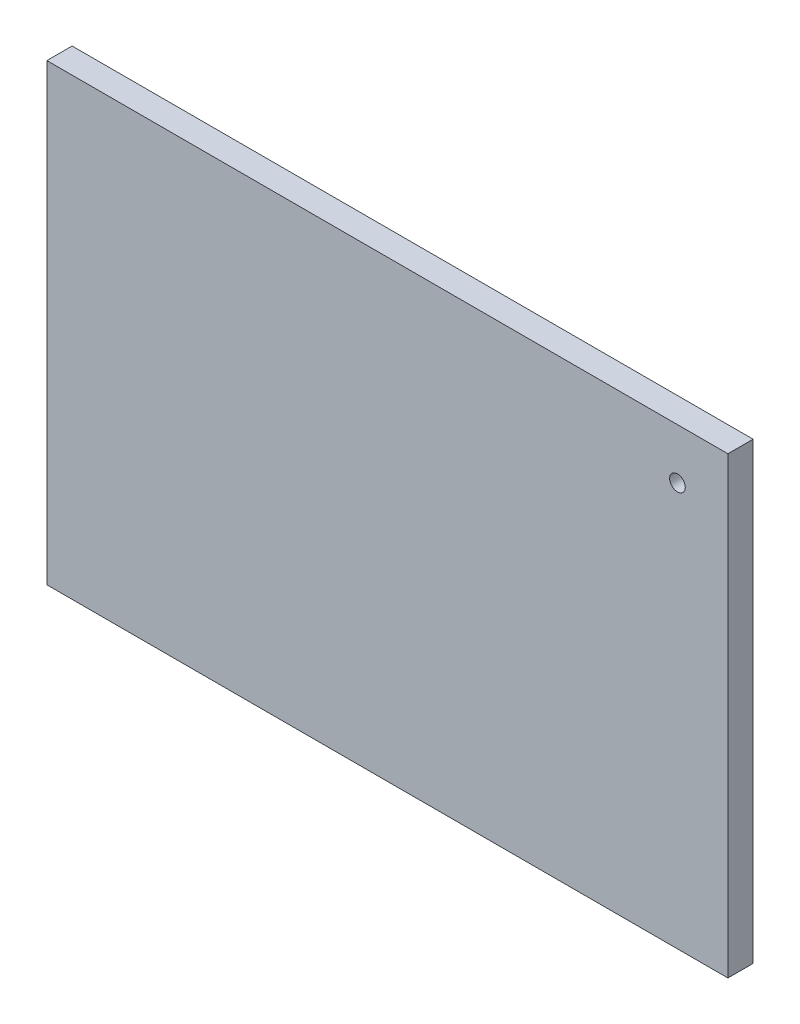
from build123d import *

# Parameters (mm, degrees)
ESQUISSE1_W        = 135
ESQUISSE1_H        = 90
ESQUISSE1_R        = 1.55
BOSS_EXTRU_1_DEPTH = 5


with BuildPart() as part:
    # Esquisse1 → Boss.-Extru.1 (new body)
    with BuildSketch(Plane.XY):
        Rectangle(ESQUISSE1_W, ESQUISSE1_H)
        with Locations((57.5, 35)):
            Circle(ESQUISSE1_R, mode=Mode.SUBTRACT)
    extrude(amount=BOSS_EXTRU_1_DEPTH)


solid = part.part
